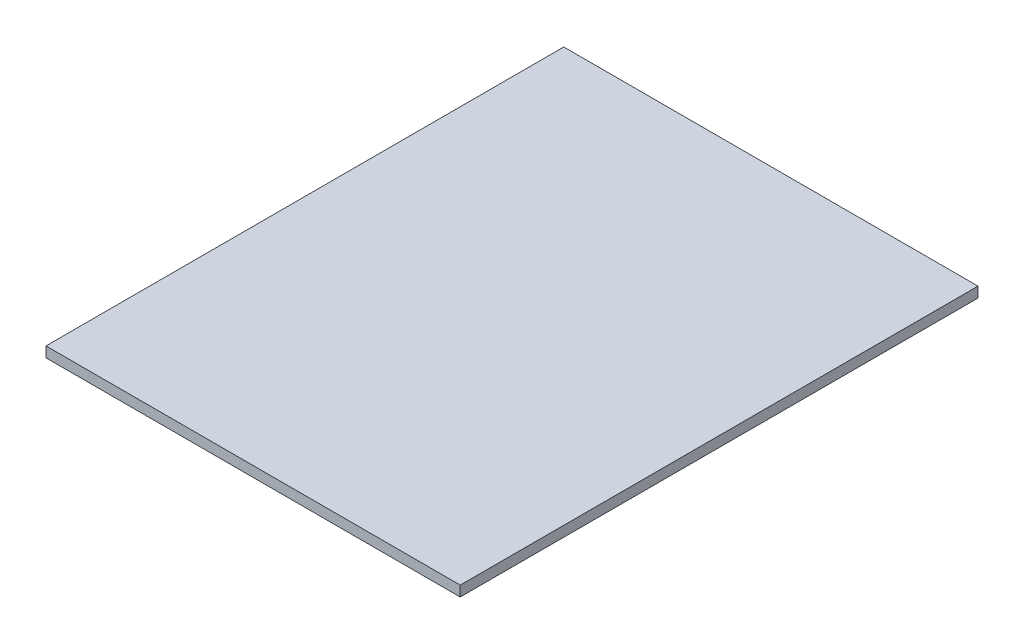
from build123d import *

# Parameters (mm, degrees)
SKETCH_1_W      = 400
SKETCH_1_H      = 500
EXTRUDE_1_DEPTH = 10


with BuildPart() as part:
    # Эскиз1 → Бобышка-Вытянуть1 (new body)
    with BuildSketch(Plane(origin=(0, 0, 0), x_dir=(1, 0, 0), z_dir=(0, 1, 0))):
        with Locations((200, 250)):
            Rectangle(SKETCH_1_W, SKETCH_1_H)
    extrude(amount=EXTRUDE_1_DEPTH)


solid = part.part
